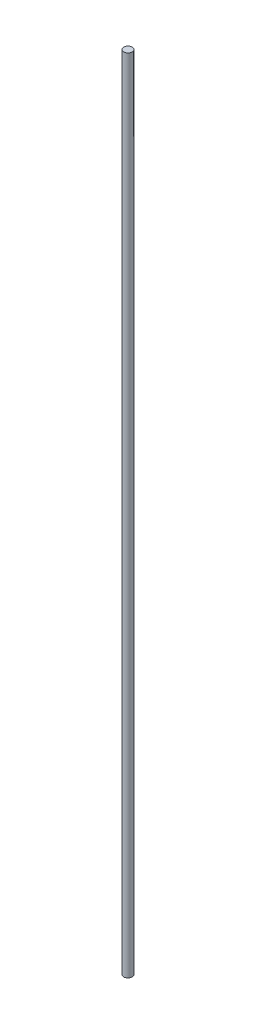
from build123d import *

# Parameters (mm, degrees)
SKETCH1_R           = 3.1
BOSS_EXTRUDE1_DEPTH = 580


with BuildPart() as part:
    # Sketch1 → Boss-Extrude1 (new body)
    with BuildSketch(Plane(origin=(0, 0, 0), x_dir=(1, 0, 0), z_dir=(0, 1, 0))):
        with Locations(Location((0, 0, 0), (0, 0, 270))):
            Circle(SKETCH1_R)
    extrude(amount=BOSS_EXTRUDE1_DEPTH)


solid = part.part
